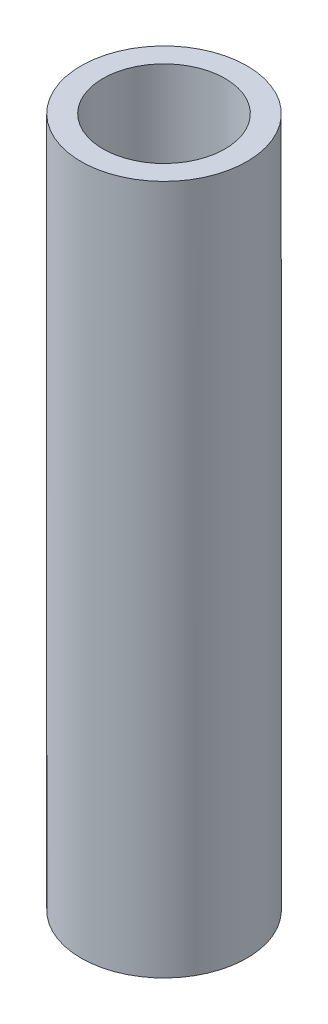
from build123d import *

# Parameters (mm, degrees)
SKETCH1_R           = 5.55625
SKETCH1_R_2         = 4.0894
BOSS_EXTRUDE1_DEPTH = 46.2


with BuildPart() as part:
    # Sketch1 → Boss-Extrude1 (new body)
    with BuildSketch(Plane(origin=(0, 0, 0), x_dir=(1, 0, 0), z_dir=(0, 1, 0))):
        with Locations(Location((0, 0, 0), (0, 0, 90))):
            Circle(SKETCH1_R)
        with Locations(Location((0, 0, 0), (0, 0, 90))):
            Circle(SKETCH1_R_2, mode=Mode.SUBTRACT)
    extrude(amount=BOSS_EXTRUDE1_DEPTH)


solid = part.part
